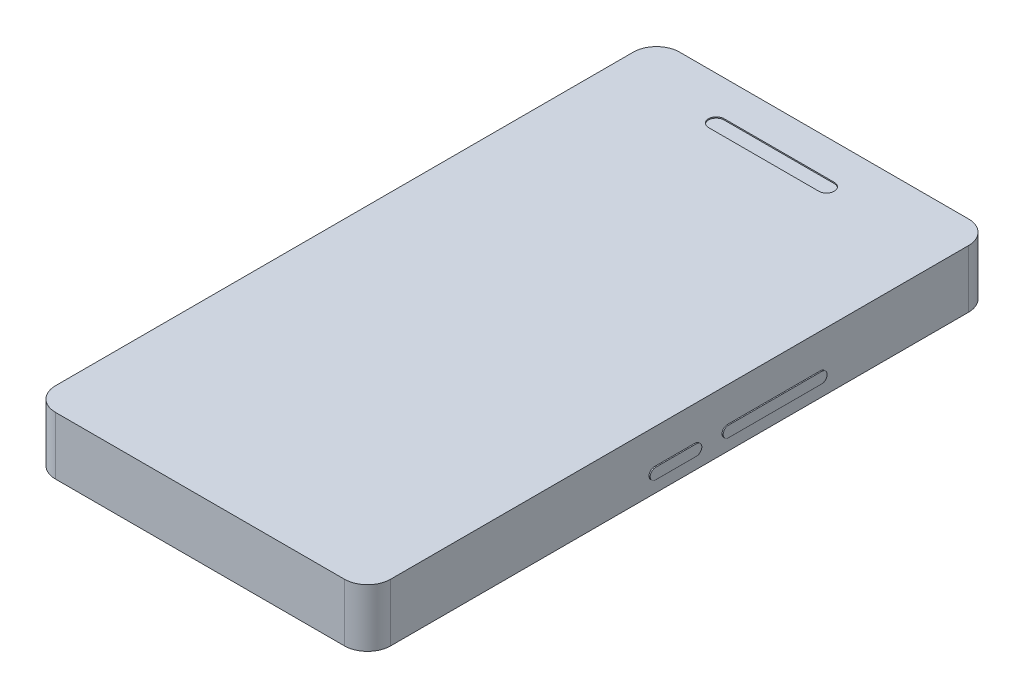
from build123d import *

# Parameters (mm, degrees)
BOSS_EXTRUDE1_DEPTH     = 12.7
BOSS_EXTRUDE2_DEPTH     = 1.016
CUT_EXTRUDE2_DEPTH      = 0.254
CUT_EXTRUDE2_DEPTH_BACK = 0.254
SKETCH8_R               = 3.782150116
SKETCH8_R_2             = 0.533461952
SKETCH7_R               = 5.190476509
CUT_EXTRUDE3_DEPTH      = 0.254
CUT_EXTRUDE5_DEPTH      = 0.254
SKETCH13_R              = 2.893074104
CUT_EXTRUDE7_DEPTH      = 11.43
CUT_EXTRUDE8_DEPTH      = 7.62
BOSS_EXTRUDE3_DEPTH     = 0.254


with BuildPart() as part:
    # Sketch2 → Boss-Extrude1 (new body)
    with BuildSketch(Plane(origin=(0, 0, 0), x_dir=(1, 0, 0), z_dir=(0, 1, 0))):
        with BuildLine():
            Line((23.304511321, 59.876164022), (-40.195488679, 59.876164022))
            ThreePointArc((-40.195488679, 59.876164022), (-43.787591127, 58.388266471), (-45.275488679, 54.796164022))
            Line((-45.275488679, 54.796164022), (-45.275488679, -72.203835978))
            ThreePointArc((-45.275488679, -72.203835978), (-43.787591127, -75.795938426), (-40.195488679, -77.283835978))
            Line((-40.195488679, -77.283835978), (23.304511321, -77.283835978))
            ThreePointArc((23.304511321, -77.283835978), (26.89661377, -75.795938426), (28.384511321, -72.203835978))
            Line((28.384511321, -72.203835978), (28.384511321, 54.796164022))
            ThreePointArc((28.384511321, 54.796164022), (26.89661377, 58.388266471), (23.304511321, 59.876164022))
        make_face()
    extrude(amount=BOSS_EXTRUDE1_DEPTH)

    # Sketch5 → Boss-Extrude2 (add)
    with BuildSketch(Plane(origin=(0, 0, 0), x_dir=(-1, 0, 0), z_dir=(0, -1, 0))):
        with BuildLine():
            Line((1.259403459, 20.324166162), (1.259403459, 47.177431984))
            ThreePointArc((1.259403459, 47.177431984), (8.256381173, 54.174409699), (15.253358888, 47.177431984))
            Line((15.253358888, 47.177431984), (15.253358888, 20.324166162))
            ThreePointArc((15.253358888, 20.324166162), (8.256381173, 13.327188447), (1.259403459, 20.324166162))
        make_face()
    extrude(amount=BOSS_EXTRUDE2_DEPTH)

    # Sketch8 → Cut-Extrude2 (cut, two sides: drawn at the far end of the back side and taken through both)
    with BuildSketch(Plane(origin=(0, -1.016, 0), x_dir=(-1, 0, 0), z_dir=(0, -1, 0)).offset(-CUT_EXTRUDE2_DEPTH_BACK)):
        with Locations(Location((8.256381173, 29.871883473, 0), (0, 0, 90))):
            Circle(SKETCH8_R)
        with Locations(Location((8.256381173, 20.324166162, 0), (0, 0, 90))):
            Circle(SKETCH8_R_2)
    extrude(amount=CUT_EXTRUDE2_DEPTH + CUT_EXTRUDE2_DEPTH_BACK, mode=Mode.SUBTRACT)

    # Sketch7 → Cut-Extrude3 (cut)
    with BuildSketch(Plane(origin=(0, -1.016, 0), x_dir=(-1, 0, 0), z_dir=(0, -1, 0))):
        with Locations(Location((8.256381173, 45.395398439, 0), (0, 0, 90))):
            Circle(SKETCH7_R)
    extrude(amount=-CUT_EXTRUDE3_DEPTH, mode=Mode.SUBTRACT)

    # Sketch10 → Cut-Extrude5 (cut)
    with BuildSketch(Plane(origin=(0, 12.7, 0), x_dir=(1, 0, 0), z_dir=(0, 1, 0))):
        with BuildLine():
            Line((-22.628551613, 52.094227135), (1.577209128, 52.094227135))
            ThreePointArc((1.577209128, 52.094227135), (3.27917668, 50.392259583), (1.577209128, 48.690292031))
            Line((1.577209128, 48.690292031), (-22.628551613, 48.690292031))
            ThreePointArc((-22.628551613, 48.690292031), (-24.330519166, 50.392259583), (-22.628551613, 52.094227135))
        make_face()
    extrude(amount=-CUT_EXTRUDE5_DEPTH, mode=Mode.SUBTRACT)

    # Sketch13 → Cut-Extrude7 (cut)
    with BuildSketch(Plane(origin=(0, 0, -59.876164022), x_dir=(-1, 0, 0), z_dir=(0, 0, -1))):
        with Locations((26.098165184, 2.993499928)):
            Circle(SKETCH13_R)
    extrude(amount=-CUT_EXTRUDE7_DEPTH, mode=Mode.SUBTRACT)

    # Sketch14 → Cut-Extrude8 (cut)
    with BuildSketch(Plane(origin=(0, 0, -59.876164022), x_dir=(-1, 0, 0), z_dir=(0, 0, -1))):
        with BuildLine():
            Line((4.185340578, 5.307383364), (13.751795184, 5.307383364))
            ThreePointArc((13.751795184, 5.307383364), (16.080302046, 2.978876501), (13.751795184, 0.650369639))
            Line((13.751795184, 0.650369639), (4.185340578, 0.650369639))
            ThreePointArc((4.185340578, 0.650369639), (1.856833715, 2.978876501), (4.185340578, 5.307383364))
        make_face()
        with BuildLine():
            Line((4.185340578, 3.812772213), (13.751795184, 3.812772213))
            ThreePointArc((13.751795184, 3.812772213), (14.585690896, 2.978876501), (13.751795184, 2.144980789))
            Line((13.751795184, 2.144980789), (4.185340578, 2.144980789))
            ThreePointArc((4.185340578, 2.144980789), (3.351444866, 2.978876501), (4.185340578, 3.812772213))
        make_face(mode=Mode.SUBTRACT)
    extrude(amount=-CUT_EXTRUDE8_DEPTH, mode=Mode.SUBTRACT)

    # Sketch16 → Boss-Extrude3 (add)
    with BuildSketch(Plane(origin=(28.384511321, 0, 0), x_dir=(0, 0, -1), z_dir=(1, 0, 0))):
        with BuildLine():
            Line((1.812614233, 5.138816206), (22.282032337, 5.138816206))
            ThreePointArc((22.282032337, 5.138816206), (23.477323285, 3.943525258), (22.282032337, 2.748234309))
            Line((22.282032337, 2.748234309), (1.812614233, 2.748234309))
            ThreePointArc((1.812614233, 2.748234309), (0.617323285, 3.943525258), (1.812614233, 5.138816206))
        make_face()
        with BuildLine():
            Line((-14.226212683, 5.138811158), (-5.261520474, 5.138811158))
            ThreePointArc((-5.261520474, 5.138811158), (-4.066234574, 3.943525258), (-5.261520474, 2.748239358))
            Line((-5.261520474, 2.748239358), (-14.226212683, 2.748239358))
            ThreePointArc((-14.226212683, 2.748239358), (-15.421498583, 3.943525258), (-14.226212683, 5.138811158))
        make_face()
    extrude(amount=BOSS_EXTRUDE3_DEPTH)


solid = part.part
